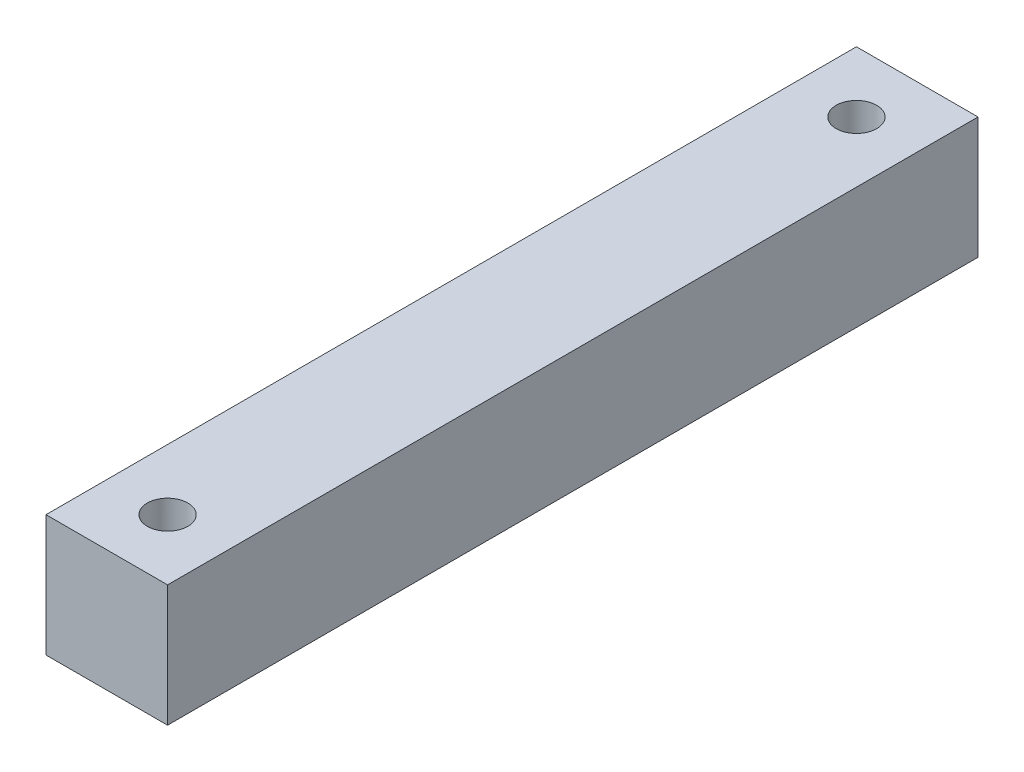
from build123d import *

# Parameters (mm, degrees)
SKETCH1_W               = 60
SKETCH1_H               = 60
BOSS_EXTRUDE1_DEPTH     = 400
SKETCH2_R               = 10
CUT_EXTRUDE1_DEPTH      = 50
CUT_EXTRUDE2_DEPTH      = 60
CUT_EXTRUDE2_DEPTH_BACK = 60
SKETCH3_R               = 10
CUT_EXTRUDE3_DEPTH      = 60
CUT_EXTRUDE3_DEPTH_BACK = 60
SKETCH4_R               = 10


with BuildPart() as part:
    # Sketch1 → Boss-Extrude1 (new body)
    with BuildSketch(Plane.XY):
        Rectangle(SKETCH1_W, SKETCH1_H)
    extrude(amount=BOSS_EXTRUDE1_DEPTH)

    # Sketch2 → Cut-Extrude1 (cut)
    with BuildSketch(Plane.XY):
        Circle(SKETCH2_R)
    extrude(amount=CUT_EXTRUDE1_DEPTH, mode=Mode.SUBTRACT)

    # Sketch3 → Cut-Extrude2 (cut, two sides: drawn at the far end of the back side and taken through both)
    with BuildSketch(Plane(origin=(0, 0, 0), x_dir=(1, 0, 0), z_dir=(0, 1, 0)).offset(-CUT_EXTRUDE2_DEPTH_BACK)):
        with Locations((0, -30)):
            Circle(SKETCH3_R)
    extrude(amount=CUT_EXTRUDE2_DEPTH + CUT_EXTRUDE2_DEPTH_BACK, mode=Mode.SUBTRACT)

    # Sketch4 → Cut-Extrude3 (cut, two sides: drawn at the far end of the back side and taken through both)
    with BuildSketch(Plane(origin=(0, 0, 0), x_dir=(1, 0, 0), z_dir=(0, 1, 0)).offset(-CUT_EXTRUDE3_DEPTH_BACK)):
        with Locations((0, -370)):
            Circle(SKETCH4_R)
    extrude(amount=CUT_EXTRUDE3_DEPTH + CUT_EXTRUDE3_DEPTH_BACK, mode=Mode.SUBTRACT)


solid = part.part
